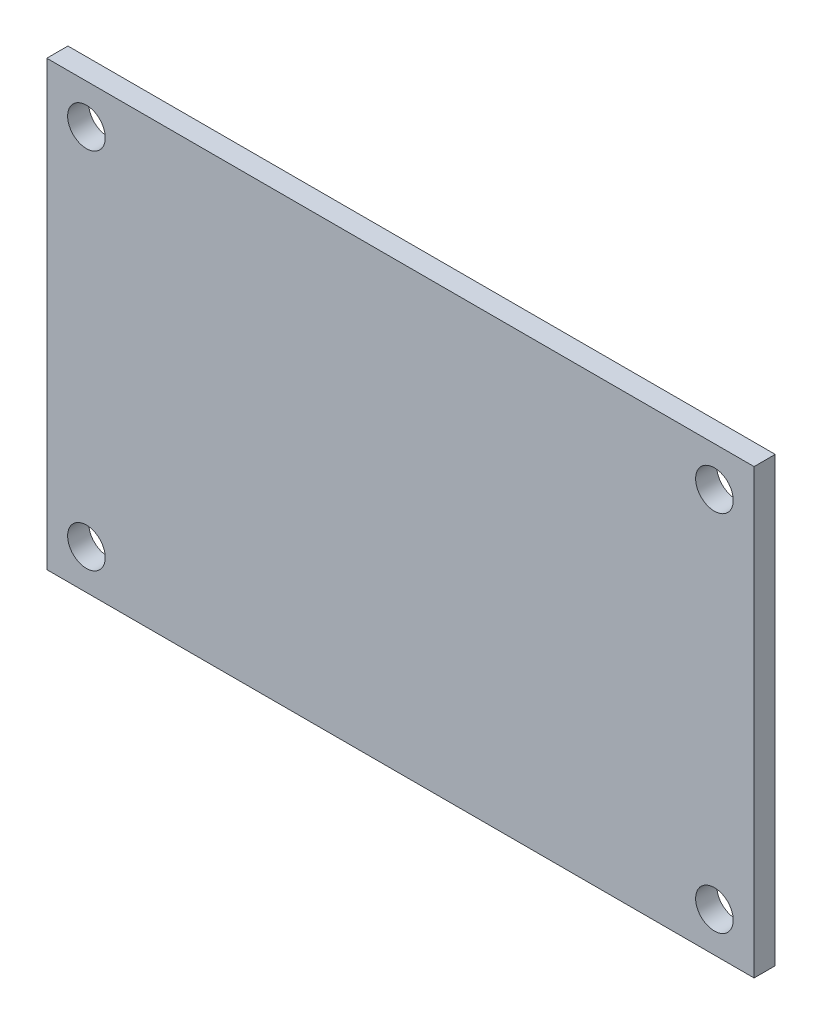
from build123d import *

# Parameters (mm, degrees)
SKETCH1_W           = 53.5
SKETCH1_H           = 33.5
BOSS_EXTRUDE1_DEPTH = 1.6
SKETCH2_R           = 1.4224
CUT_EXTRUDE1_DEPTH  = 64.143170652


with BuildPart() as part:
    # Sketch1 → Boss-Extrude1 (new body)
    with BuildSketch(Plane.XY):
        with Locations((26.75, -16.75)):
            Rectangle(SKETCH1_W, SKETCH1_H)
    extrude(amount=BOSS_EXTRUDE1_DEPTH)

    # Sketch2 → Cut-Extrude1 (cut, through all)
    with BuildSketch(Plane.XY.offset(1.6)):
        with Locations((3, -3)):
            Circle(SKETCH2_R)
        with Locations((50.5, -3)):
            Circle(SKETCH2_R)
        with Locations((3, -30.5)):
            Circle(SKETCH2_R)
        with Locations((50.5, -30.5)):
            Circle(SKETCH2_R)
    extrude(amount=-CUT_EXTRUDE1_DEPTH, mode=Mode.SUBTRACT)


solid = part.part
